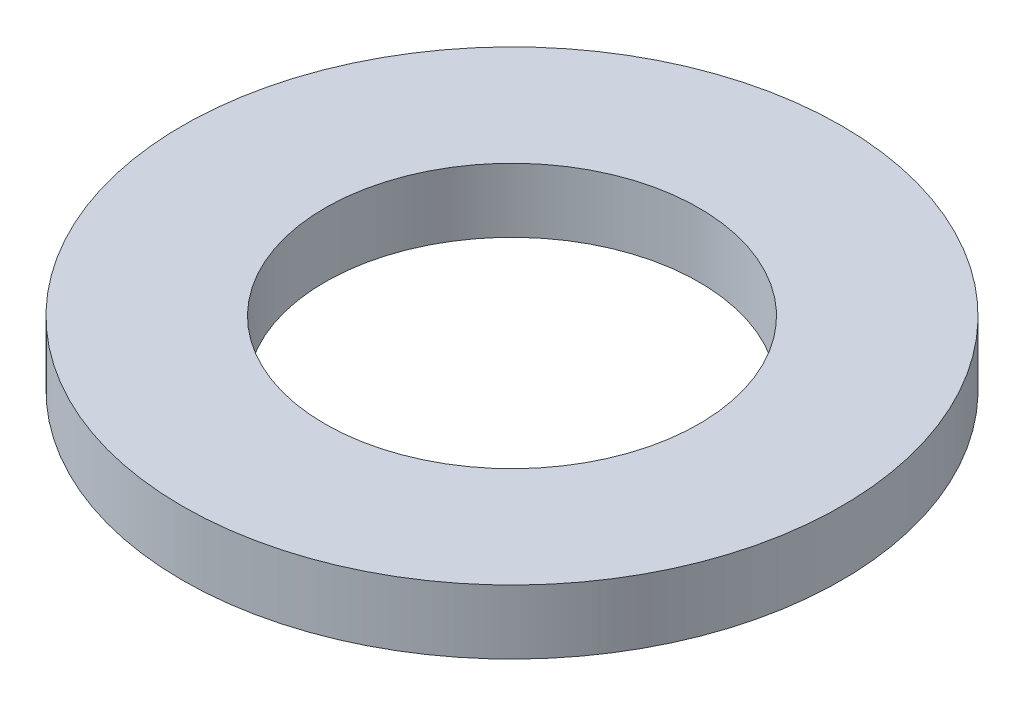
from build123d import *

# Parameters (mm, degrees)
SKETCH1_R           = 61.658515343
SKETCH1_R_2         = 35
BOSS_EXTRUDE1_DEPTH = 12


with BuildPart() as part:
    # Sketch1 → Boss-Extrude1 (new body)
    with BuildSketch(Plane(origin=(0, 0, 0), x_dir=(1, 0, 0), z_dir=(0, 1, 0))):
        with Locations(Location((0, 0, 0), (0, 0, 270))):
            Circle(SKETCH1_R)
        with Locations(Location((0, 0, 0), (0, 0, 270))):
            Circle(SKETCH1_R_2, mode=Mode.SUBTRACT)
    extrude(amount=BOSS_EXTRUDE1_DEPTH)


solid = part.part
